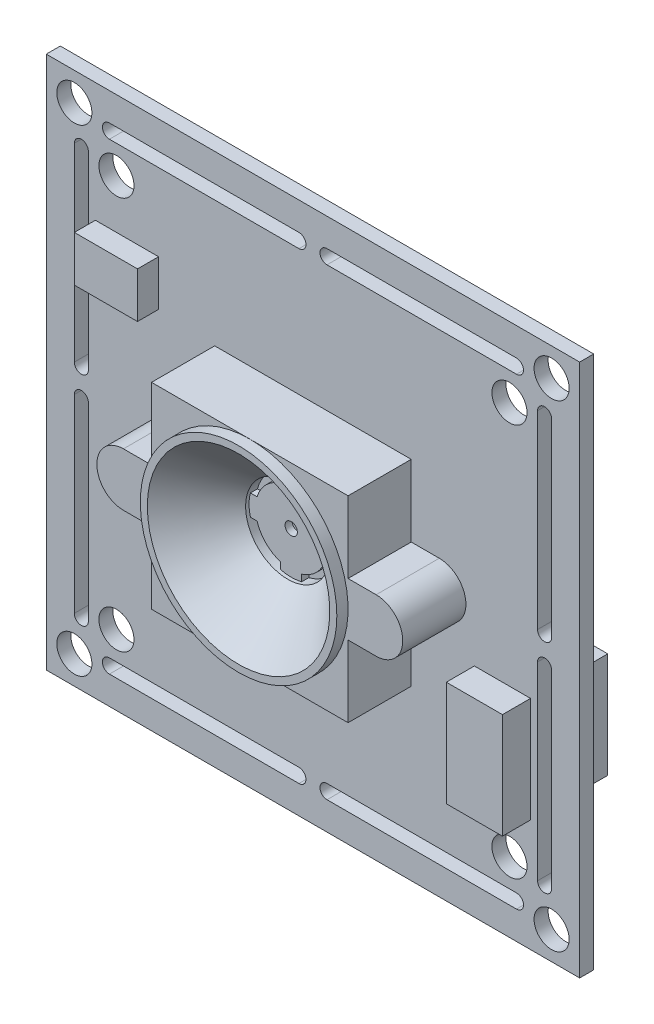
from build123d import *

# Parameters (mm, degrees)
SKETCH_1_W          = 38
SKETCH_1_H          = 38
SKETCH_1_R          = 1.25
EXTRUDE_1_DEPTH     = 1
EXTRUDE_2_DEPTH     = 4.5
SKETCH_3_R          = 7
EXTRUDE_3_DEPTH     = 0.8
CUT_EXTRUDE_START   = -0.5
SKETCH_5_R          = 0.438948094
CUT_EXTRUDE_1_DEPTH = 0.5
SKETCH_6_W          = 12.323185316
SKETCH_6_H          = 22.259619553
EXTRUDE_4_DEPTH     = 3
SKETCH_7_W          = 4
SKETCH_7_H          = 7.5
EXTRUDE_5_DEPTH     = 4.5
SKETCH_9_W          = 4.5
SKETCH_9_H          = 3.25
EXTRUDE_6_DEPTH     = 1.5
SKETCH_10_W         = 4
SKETCH_10_H         = 7.5
EXTRUDE_7_DEPTH     = 2


with BuildPart() as part:
    # ｽｹｯﾁ1 → ﾎﾞｽ - 押し出し1 (new body)
    with BuildSketch(Plane.XY):
        Rectangle(SKETCH_1_W, SKETCH_1_H)
        with Locations((17, 17)):
            Circle(SKETCH_1_R, mode=Mode.SUBTRACT)
        with Locations((14, 14)):
            Circle(SKETCH_1_R, mode=Mode.SUBTRACT)
        with Locations((17, -17)):
            Circle(SKETCH_1_R, mode=Mode.SUBTRACT)
        with Locations((14, -14)):
            Circle(SKETCH_1_R, mode=Mode.SUBTRACT)
        with Locations((-17, -17)):
            Circle(SKETCH_1_R, mode=Mode.SUBTRACT)
        with Locations((-14, -14)):
            Circle(SKETCH_1_R, mode=Mode.SUBTRACT)
        with Locations((-17, 17)):
            Circle(SKETCH_1_R, mode=Mode.SUBTRACT)
        with Locations((-14, 14)):
            Circle(SKETCH_1_R, mode=Mode.SUBTRACT)
        with BuildLine():
            Line((1, 17), (14.5, 17))
            ThreePointArc((14.5, 17), (15, 16.5), (14.5, 16))
            Line((14.5, 16), (1, 16))
            ThreePointArc((1, 16), (0.5, 16.5), (1, 17))
        make_face(mode=Mode.SUBTRACT)
        with BuildLine():
            Line((-1, 17), (-14.5, 17))
            ThreePointArc((-14.5, 17), (-15, 16.5), (-14.5, 16))
            Line((-14.5, 16), (-1, 16))
            ThreePointArc((-1, 16), (-0.5, 16.5), (-1, 17))
        make_face(mode=Mode.SUBTRACT)
        with BuildLine():
            Line((17, -1), (17, -14.5))
            ThreePointArc((17, -14.5), (16.5, -15), (16, -14.5))
            Line((16, -14.5), (16, -1))
            ThreePointArc((16, -1), (16.5, -0.5), (17, -1))
        make_face(mode=Mode.SUBTRACT)
        with BuildLine():
            Line((17, 1), (17, 14.5))
            ThreePointArc((17, 14.5), (16.5, 15), (16, 14.5))
            Line((16, 14.5), (16, 1))
            ThreePointArc((16, 1), (16.5, 0.5), (17, 1))
        make_face(mode=Mode.SUBTRACT)
        with BuildLine():
            Line((-1, -17), (-14.5, -17))
            ThreePointArc((-14.5, -17), (-15, -16.5), (-14.5, -16))
            Line((-14.5, -16), (-1, -16))
            ThreePointArc((-1, -16), (-0.5, -16.5), (-1, -17))
        make_face(mode=Mode.SUBTRACT)
        with BuildLine():
            Line((1, -17), (14.5, -17))
            ThreePointArc((14.5, -17), (15, -16.5), (14.5, -16))
            Line((14.5, -16), (1, -16))
            ThreePointArc((1, -16), (0.5, -16.5), (1, -17))
        make_face(mode=Mode.SUBTRACT)
        with BuildLine():
            Line((-17, 1), (-17, 14.5))
            ThreePointArc((-17, 14.5), (-16.5, 15), (-16, 14.5))
            Line((-16, 14.5), (-16, 1))
            ThreePointArc((-16, 1), (-16.5, 0.5), (-17, 1))
        make_face(mode=Mode.SUBTRACT)
        with BuildLine():
            Line((-17, -1), (-17, -14.5))
            ThreePointArc((-17, -14.5), (-16.5, -15), (-16, -14.5))
            Line((-16, -14.5), (-16, -1))
            ThreePointArc((-16, -1), (-16.5, -0.5), (-17, -1))
        make_face(mode=Mode.SUBTRACT)
    extrude(amount=EXTRUDE_1_DEPTH)

    # ｽｹｯﾁ2 → ﾎﾞｽ - 押し出し2 (add)
    with BuildSketch(Plane.XY.offset(1)):
        with BuildLine():
            Line((-7, -7), (7, -7))
            Line((7, -7), (7, -1.896601527))
            Line((7, -1.896601527), (9, -1.896601527))
            ThreePointArc((9, -1.896601527), (10.896601527, 0), (9, 1.896601527))
            Line((9, 1.896601527), (7, 1.896601527))
            Line((7, 1.896601527), (7, 7))
            Line((7, 7), (-7, 7))
            Line((-7, 7), (-7, 1.896601527))
            Line((-7, 1.896601527), (-9, 1.896601527))
            ThreePointArc((-9, 1.896601527), (-10.896601527, 0), (-9, -1.896601527))
            Line((-9, -1.896601527), (-7, -1.896601527))
            Line((-7, -1.896601527), (-7, -7))
        make_face()
    extrude(amount=EXTRUDE_2_DEPTH)

    # ｽｹｯﾁ3 → ﾎﾞｽ - 押し出し3 (add)
    with BuildSketch(Plane.XY.offset(5.5)):
        with Locations(Location((0, 0, 0), (0, 0, 270))):
            Circle(SKETCH_3_R)
    extrude(amount=EXTRUDE_3_DEPTH)

    # ｽｹｯﾁ4 → ｶｯﾄ - 回転1 (revolve, cut)
    with BuildSketch(Plane(origin=(0, 0, 0), x_dir=(1, 0, 0), z_dir=(0, 1, 0))):
        Polygon((-6.5, -6.3), (-3, -2.8), (-3, -2.55), (0, -2.55), (0, -6.3), align=None)
    revolve(axis=Axis((0, 0, 0), (0, 0, 1)), mode=Mode.SUBTRACT)

    # ｽｹｯﾁ5 → ｶｯﾄ - 押し出し1 (cut)
    with BuildSketch(Plane.XY.offset(2.55).offset(CUT_EXTRUDE_START)):
        Circle(SKETCH_5_R)
        with BuildLine():
            Line((0.75, 2.90473751), (0.75, 2.431581232))
            ThreePointArc((0.75, 2.431581232), (1.79931755, 1.79931755), (2.431581232, 0.75))
            Line((2.431581232, 0.75), (2.90473751, 0.75))
            ThreePointArc((2.90473751, 0.75), (2.121320344, 2.121320344), (0.75, 2.90473751))
        make_face()
        with BuildLine():
            Line((2.90473751, -0.75), (2.431581232, -0.75))
            ThreePointArc((2.431581232, -0.75), (1.79931755, -1.79931755), (0.75, -2.431581232))
            Line((0.75, -2.431581232), (0.75, -2.90473751))
            ThreePointArc((0.75, -2.90473751), (2.121320344, -2.121320344), (2.90473751, -0.75))
        make_face()
        with BuildLine():
            Line((-0.75, -2.90473751), (-0.75, -2.431581232))
            ThreePointArc((-0.75, -2.431581232), (-1.79931755, -1.79931755), (-2.431581232, -0.75))
            Line((-2.431581232, -0.75), (-2.90473751, -0.75))
            ThreePointArc((-2.90473751, -0.75), (-2.121320344, -2.121320344), (-0.75, -2.90473751))
        make_face()
        with BuildLine():
            Line((-2.90473751, 0.75), (-2.431581232, 0.75))
            ThreePointArc((-2.431581232, 0.75), (-1.79931755, 1.79931755), (-0.75, 2.431581232))
            Line((-0.75, 2.431581232), (-0.75, 2.90473751))
            ThreePointArc((-0.75, 2.90473751), (-2.121320344, 2.121320344), (-2.90473751, 0.75))
        make_face()
    extrude(amount=CUT_EXTRUDE_1_DEPTH, mode=Mode.SUBTRACT)

    # ｽｹｯﾁ6 → ﾎﾞｽ - 押し出し4 (add)
    with BuildSketch(Plane(origin=(0, 0, 0), x_dir=(-1, 0, 0), z_dir=(0, 0, -1))):
        with Locations((0, 2.099913023)):
            Rectangle(SKETCH_6_W, SKETCH_6_H)
    extrude(amount=EXTRUDE_4_DEPTH)

    # ｽｹｯﾁ7 → ﾎﾞｽ - 押し出し5 (add)
    with BuildSketch(Plane(origin=(0, 0, 0), x_dir=(-1, 0, 0), z_dir=(0, 0, -1))):
        with Locations((-13.5, -7.25)):
            Rectangle(SKETCH_7_W, SKETCH_7_H)
    extrude(amount=EXTRUDE_5_DEPTH)

    # ｽｹｯﾁ9 → ﾎﾞｽ - 押し出し6 (add)
    with BuildSketch(Plane.XY.offset(1)):
        with Locations((-13.25, 8.875)):
            Rectangle(SKETCH_9_W, SKETCH_9_H)
    extrude(amount=EXTRUDE_6_DEPTH)

    # ｽｹｯﾁ10 → ﾎﾞｽ - 押し出し7 (add)
    with BuildSketch(Plane.XY.offset(1)):
        with Locations((13.5, -7.25)):
            Rectangle(SKETCH_10_W, SKETCH_10_H)
    extrude(amount=EXTRUDE_7_DEPTH)


solid = part.part
